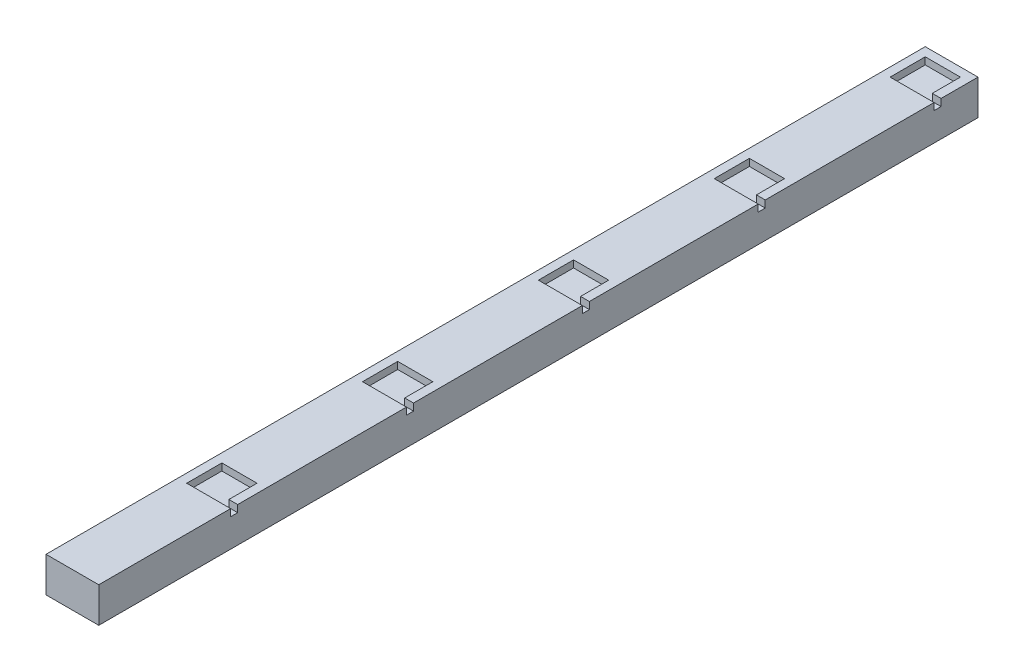
from build123d import *

# Parameters (mm, degrees)
SKETCH1_W           = 15
SKETCH1_H           = 300
BOSS_EXTRUDE1_DEPTH = 10
CUT_EXTRUDE2_DEPTH  = 2
CUT_EXTRUDE3_DEPTH  = 2
CUT_EXTRUDE4_DEPTH  = 2
CUT_EXTRUDE5_DEPTH  = 2
CUT_EXTRUDE6_DEPTH  = 2
SKETCH8_W           = 15
SKETCH8_H           = 10
CUT_EXTRUDE7_DEPTH  = 50


with BuildPart() as part:
    # Sketch1 → Boss-Extrude1 (new body)
    with BuildSketch(Plane(origin=(0, 0, 0), x_dir=(1, 0, 0), z_dir=(0, 1, 0))):
        with Locations((7.5, 150)):
            Rectangle(SKETCH1_W, SKETCH1_H)
    extrude(amount=BOSS_EXTRUDE1_DEPTH)

    # Sketch2 → Cut-Extrude2 (cut)
    with BuildSketch(Plane(origin=(0, 10, 0), x_dir=(1, 0, 0), z_dir=(0, 1, 0))):
        Polygon((2.5, 297.5), (12.5, 297.5), (12.5, 289.5), (15, 289.5), (15, 287.5), (12.5, 287.5), (2.5, 287.5), align=None)
    extrude(amount=-CUT_EXTRUDE2_DEPTH, mode=Mode.SUBTRACT)

    # Sketch3 → Cut-Extrude3 (cut)
    with BuildSketch(Plane(origin=(0, 10, 0), x_dir=(1, 0, 0), z_dir=(0, 1, 0))):
        Polygon((2.5, 247.5), (12.5, 247.5), (12.5, 239.5), (15, 239.5), (15, 237.5), (12.5, 237.5), (2.5, 237.5), align=None)
    extrude(amount=-CUT_EXTRUDE3_DEPTH, mode=Mode.SUBTRACT)

    # Sketch4 → Cut-Extrude4 (cut)
    with BuildSketch(Plane(origin=(0, 10, 0), x_dir=(1, 0, 0), z_dir=(0, 1, 0))):
        Polygon((12.5, 187.5), (15, 187.5), (15, 189.5), (12.5, 189.5), (12.5, 197.5), (2.5, 197.5), (2.5, 187.5), align=None)
    extrude(amount=-CUT_EXTRUDE4_DEPTH, mode=Mode.SUBTRACT)

    # Sketch5 → Cut-Extrude5 (cut)
    with BuildSketch(Plane(origin=(0, 10, 0), x_dir=(1, 0, 0), z_dir=(0, 1, 0))):
        Polygon((12.5, 137.5), (15, 137.5), (15, 139.5), (12.5, 139.5), (12.5, 147.5), (2.5, 147.5), (2.5, 137.5), align=None)
    extrude(amount=-CUT_EXTRUDE5_DEPTH, mode=Mode.SUBTRACT)

    # Sketch6 → Cut-Extrude6 (cut)
    with BuildSketch(Plane(origin=(0, 10, 0), x_dir=(1, 0, 0), z_dir=(0, 1, 0))):
        Polygon((12.5, 87.5), (15, 87.5), (15, 89.5), (12.5, 89.5), (12.5, 97.5), (2.5, 97.5), (2.5, 87.5), align=None)
    extrude(amount=-CUT_EXTRUDE6_DEPTH, mode=Mode.SUBTRACT)

    # Sketch8 → Cut-Extrude7 (cut)
    with BuildSketch(Plane.XY):
        with Locations((7.5, 5)):
            Rectangle(SKETCH8_W, SKETCH8_H)
    extrude(amount=-CUT_EXTRUDE7_DEPTH, mode=Mode.SUBTRACT)


solid = part.part
